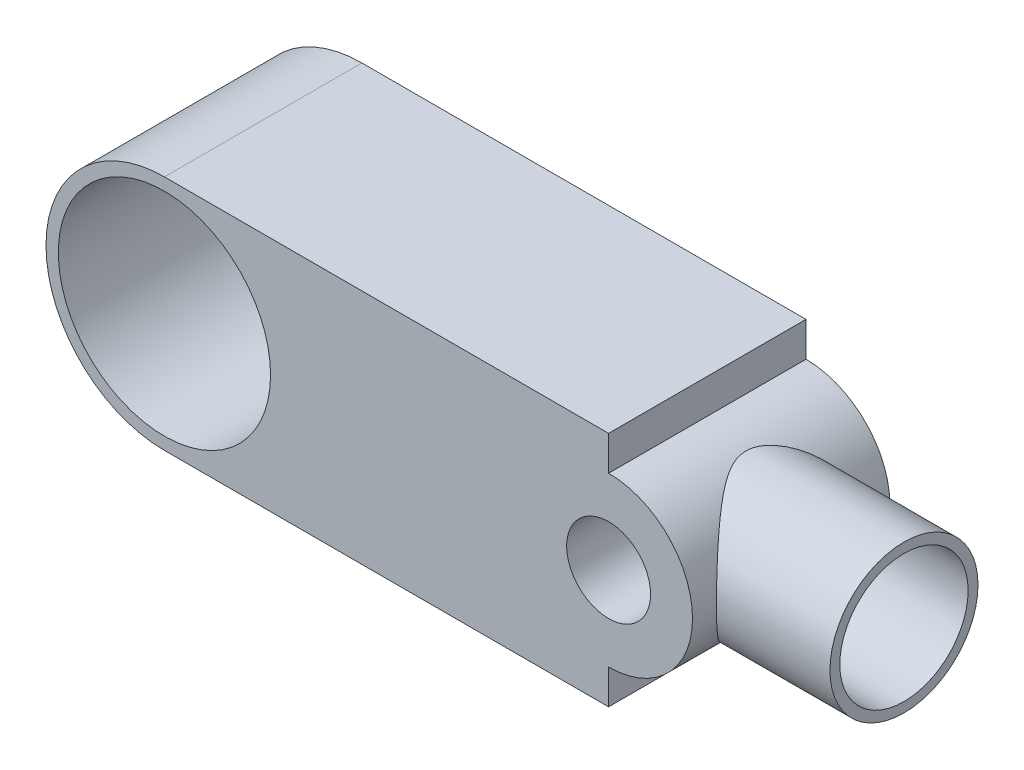
from build123d import *

# Parameters (mm, degrees)
SKETCH1_R           = 17
BOSS_EXTRUDE2_DEPTH = 40
SKETCH2_R           = 8.5
CUT_EXTRUDE1_DEPTH  = 38
CUT_EXTRUDE2_START  = -38
SKETCH3_R           = 8.5
CUT_EXTRUDE2_DEPTH  = 38
SKETCH4_R           = 15
SKETCH4_R_2         = 13
BOSS_EXTRUDE3_DEPTH = 40
CUT_EXTRUDE4_START  = -50
SKETCH6_R           = 8.5
CUT_EXTRUDE4_DEPTH  = 50
BOSS_EXTRUDE4_START = -40
BOSS_EXTRUDE4_DEPTH = 40
SKETCH11_R          = 21.5
CUT_EXTRUDE5_DEPTH  = 35
SKETCH12_R          = 5
CUT_EXTRUDE6_DEPTH  = 122.642920086


with BuildPart() as part:
    # Sketch1 → Boss-Extrude2 (new body)
    with BuildSketch(Plane.XY):
        Circle(SKETCH1_R)
    extrude(amount=BOSS_EXTRUDE2_DEPTH)

    # Sketch2 → Cut-Extrude1 (cut)
    with BuildSketch(Plane.XY.offset(40)):
        Circle(SKETCH2_R)
    extrude(amount=-CUT_EXTRUDE1_DEPTH, mode=Mode.SUBTRACT)

    # Sketch3 → Cut-Extrude2 (cut)
    with BuildSketch(Plane(origin=(0, 0, 0), x_dir=(-1, 0, 0), z_dir=(0, 0, -1)).offset(CUT_EXTRUDE2_START)):
        with Locations(Location((0, 0, 0), (0, 0, 180))):
            Circle(SKETCH3_R)
    extrude(amount=CUT_EXTRUDE2_DEPTH, mode=Mode.SUBTRACT)

    # Sketch4 → Boss-Extrude3 (add)
    with BuildSketch(Plane(origin=(0, 0, 0), x_dir=(0, 0, -1), z_dir=(1, 0, 0))):
        with Locations((-20.148533522, 0)):
            Circle(SKETCH4_R)
        with Locations(Location((-20.148533522, 0, 0), (0, 0, 180))):
            Circle(SKETCH4_R_2, mode=Mode.SUBTRACT)
    extrude(amount=BOSS_EXTRUDE3_DEPTH)

    # Sketch6 → Cut-Extrude4 (cut)
    with BuildSketch(Plane(origin=(0, 0, 0), x_dir=(-1, 0, 0), z_dir=(0, 0, -1)).offset(CUT_EXTRUDE4_START)):
        with Locations(Location((0, 0, 0), (0, 0, 180))):
            Circle(SKETCH6_R)
    extrude(amount=CUT_EXTRUDE4_DEPTH, mode=Mode.SUBTRACT)

    # Sketch9 → Boss-Extrude4 (add)
    with BuildSketch(Plane.XY.offset(40).offset(BOSS_EXTRUDE4_START)):
        with BuildLine():
            ThreePointArc((-90, 24), (-114, 0), (-90, -24))
            Line((-90, -24), (0, -24))
            Line((0, -24), (0, -17))
            ThreePointArc((0, -17), (-17, 0), (0, 17))
            Line((0, 17), (0, 24))
            Line((0, 24), (-90, 24))
        make_face()
    extrude(amount=BOSS_EXTRUDE4_DEPTH)

    # Sketch11 → Cut-Extrude5 (cut)
    with BuildSketch(Plane.XY.offset(40)):
        with Locations((-90, 0)):
            Circle(SKETCH11_R)
    extrude(amount=-CUT_EXTRUDE5_DEPTH, mode=Mode.SUBTRACT)

    # Sketch12 → Cut-Extrude6 (cut, through all)
    with BuildSketch(Plane.XY.offset(5)):
        with Locations((-90, 0)):
            Circle(SKETCH12_R)
    extrude(amount=-CUT_EXTRUDE6_DEPTH, mode=Mode.SUBTRACT)


solid = part.part
